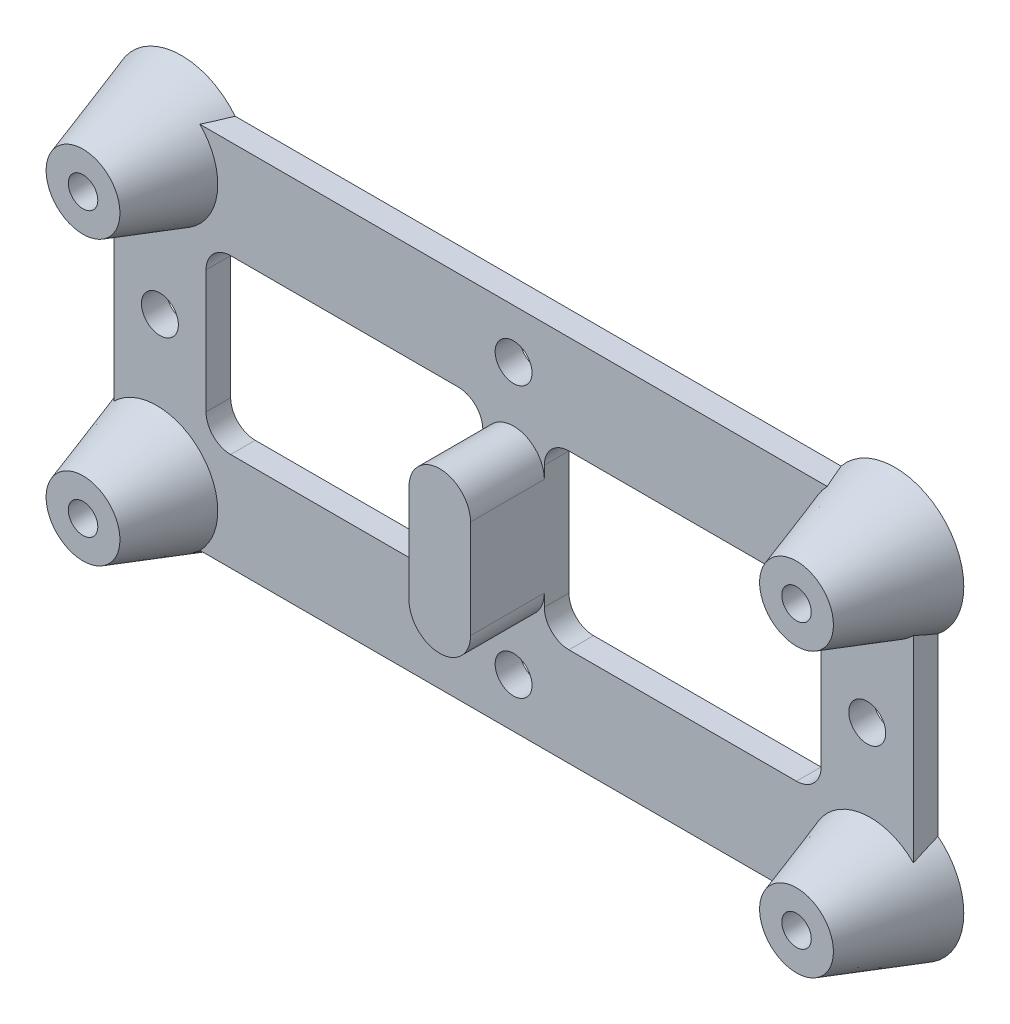
from build123d import *

# Parameters (mm, degrees)
ESQUISSE1_W                  = 65
ESQUISSE1_H                  = 30
BOSS_EXTRU_1_DEPTH           = 2
ESQUISSE2_R                  = 3
BOSS_EXTRU_2_DEPTH           = 8
BOSS_EXTRU_2_DRAFT           = 18
BOSS_EXTRU_2_PROFILE_2_DEPTH = 8
BOSS_EXTRU_2_PROFILE_2_DRAFT = 18
BOSS_EXTRU_2_PROFILE_3_DEPTH = 8
BOSS_EXTRU_2_PROFILE_3_DRAFT = 18
BOSS_EXTRU_2_PROFILE_4_DEPTH = 8
BOSS_EXTRU_2_PROFILE_4_DRAFT = 18
ENL_V_MAT_EXTRU_2_REACH      = 41.058
ESQUISSE4_W                  = 22.5
ESQUISSE4_H                  = 14
ENL_V_MAT_EXTRU_3_REACH      = 41.058
ESQUISSE5_R                  = 1.5
CONG_1_R                     = 2
BOSS_EXTRU_3_REACH           = 41.415
ENL_V_MAT_EXTRU_4_REACH      = 41.415
ESQUISSE7_R                  = 1.2


with BuildPart() as part:
    # Esquisse1 → Boss.-Extru.1 (new body)
    with BuildSketch(Plane.XY):
        Rectangle(ESQUISSE1_W, ESQUISSE1_H)
    extrude(amount=BOSS_EXTRU_1_DEPTH)


with BuildPart() as boss_extru_2_tool:
    # Esquisse2 → Boss.-Extru.2 (with draft: the straight prism first)
    with BuildSketch(Plane.XY.offset(8)):
        with Locations((-29, 11.5)):
            Circle(ESQUISSE2_R)
    extrude(amount=-BOSS_EXTRU_2_DEPTH)
    # Boss.-Extru.2: the draft: its side faces are tilted about the plane it starts from
    boss_extru_2_sides = [boss_extru_2_tool.faces().sort_by_distance(p)[0] for p in [
        (-32, 11.5, 4),
    ]]
    draft(boss_extru_2_sides, Plane.XY.offset(8), BOSS_EXTRU_2_DRAFT)


with BuildPart() as part_1:
    add(part.part)

    # Boss.-Extru.2: add boss_extru_2_tool
    add(boss_extru_2_tool.part)


with BuildPart() as boss_extru_2_profile_2_tool:
    # Esquisse2 → Boss.-Extru.2 profile 2 (with draft: the straight prism first)
    with BuildSketch(Plane.XY.offset(8)):
        with Locations((29, 11.5)):
            Circle(ESQUISSE2_R)
    extrude(amount=-BOSS_EXTRU_2_PROFILE_2_DEPTH)
    # Boss.-Extru.2 profile 2: the draft: its side faces are tilted about the plane it starts from
    boss_extru_2_profile_2_sides = [boss_extru_2_profile_2_tool.faces().sort_by_distance(p)[0] for p in [
        (26, 11.5, 4),
    ]]
    draft(boss_extru_2_profile_2_sides, Plane.XY.offset(8), BOSS_EXTRU_2_PROFILE_2_DRAFT)


with BuildPart() as part_2:
    add(part_1.part)

    # Boss.-Extru.2 profile 2: add boss_extru_2_profile_2_tool
    add(boss_extru_2_profile_2_tool.part)


with BuildPart() as boss_extru_2_profile_3_tool:
    # Esquisse2 → Boss.-Extru.2 profile 3 (with draft: the straight prism first)
    with BuildSketch(Plane.XY.offset(8)):
        with Locations((29, -11.5)):
            Circle(ESQUISSE2_R)
    extrude(amount=-BOSS_EXTRU_2_PROFILE_3_DEPTH)
    # Boss.-Extru.2 profile 3: the draft: its side faces are tilted about the plane it starts from
    boss_extru_2_profile_3_sides = [boss_extru_2_profile_3_tool.faces().sort_by_distance(p)[0] for p in [
        (26, -11.5, 4),
    ]]
    draft(boss_extru_2_profile_3_sides, Plane.XY.offset(8), BOSS_EXTRU_2_PROFILE_3_DRAFT)


with BuildPart() as part_3:
    add(part_2.part)

    # Boss.-Extru.2 profile 3: add boss_extru_2_profile_3_tool
    add(boss_extru_2_profile_3_tool.part)


with BuildPart() as boss_extru_2_profile_4_tool:
    # Esquisse2 → Boss.-Extru.2 profile 4 (with draft: the straight prism first)
    with BuildSketch(Plane.XY.offset(8)):
        with Locations((-29, -11.5)):
            Circle(ESQUISSE2_R)
    extrude(amount=-BOSS_EXTRU_2_PROFILE_4_DEPTH)
    # Boss.-Extru.2 profile 4: the draft: its side faces are tilted about the plane it starts from
    boss_extru_2_profile_4_sides = [boss_extru_2_profile_4_tool.faces().sort_by_distance(p)[0] for p in [
        (-32, -11.5, 4),
    ]]
    draft(boss_extru_2_profile_4_sides, Plane.XY.offset(8), BOSS_EXTRU_2_PROFILE_4_DRAFT)


with BuildPart() as part_4:
    add(part_3.part)

    # Boss.-Extru.2 profile 4: add boss_extru_2_profile_4_tool
    add(boss_extru_2_profile_4_tool.part)

    # Esquisse4 → Enlèv. mat.-Extru.2 (cut, up to next)
    with BuildSketch(Plane.XY.offset(2), mode=Mode.PRIVATE) as enl_v_mat_extru_2_sk1:
        with Locations((13.75, 0)):
            Rectangle(ESQUISSE4_W, ESQUISSE4_H)
    enl_v_mat_extru_2_tool1 = extrude(enl_v_mat_extru_2_sk1.sketch, amount=-ENL_V_MAT_EXTRU_2_REACH, mode=Mode.PRIVATE) & part_4.part
    # Esquisse4 → Enlèv. mat.-Extru.2 (cut, up to next)
    with BuildSketch(Plane.XY.offset(2), mode=Mode.PRIVATE) as enl_v_mat_extru_2_sk2:
        with Locations((-13.75, 0)):
            Rectangle(ESQUISSE4_W, ESQUISSE4_H)
    enl_v_mat_extru_2_tool2 = extrude(enl_v_mat_extru_2_sk2.sketch, amount=-ENL_V_MAT_EXTRU_2_REACH, mode=Mode.PRIVATE) & part_4.part
    add(enl_v_mat_extru_2_tool1.solids().sort_by_distance((13.75, 0, 2))[0], mode=Mode.SUBTRACT)
    add(enl_v_mat_extru_2_tool2.solids().sort_by_distance((-13.75, 0, 2))[0], mode=Mode.SUBTRACT)

    # Esquisse5 → Enlèv. mat.-Extru.3 (cut, up to next)
    with BuildSketch(Plane.XY.offset(2), mode=Mode.PRIVATE) as enl_v_mat_extru_3_sk1:
        with Locations((-28.75, 0)):
            Circle(ESQUISSE5_R)
    enl_v_mat_extru_3_tool1 = extrude(enl_v_mat_extru_3_sk1.sketch, amount=-ENL_V_MAT_EXTRU_3_REACH, mode=Mode.PRIVATE) & part_4.part
    # Esquisse5 → Enlèv. mat.-Extru.3 (cut, up to next)
    with BuildSketch(Plane.XY.offset(2), mode=Mode.PRIVATE) as enl_v_mat_extru_3_sk2:
        with Locations((0, 11)):
            Circle(ESQUISSE5_R)
    enl_v_mat_extru_3_tool2 = extrude(enl_v_mat_extru_3_sk2.sketch, amount=-ENL_V_MAT_EXTRU_3_REACH, mode=Mode.PRIVATE) & part_4.part
    # Esquisse5 → Enlèv. mat.-Extru.3 (cut, up to next)
    with BuildSketch(Plane.XY.offset(2), mode=Mode.PRIVATE) as enl_v_mat_extru_3_sk3:
        with Locations((0, -11)):
            Circle(ESQUISSE5_R)
    enl_v_mat_extru_3_tool3 = extrude(enl_v_mat_extru_3_sk3.sketch, amount=-ENL_V_MAT_EXTRU_3_REACH, mode=Mode.PRIVATE) & part_4.part
    # Esquisse5 → Enlèv. mat.-Extru.3 (cut, up to next)
    with BuildSketch(Plane.XY.offset(2), mode=Mode.PRIVATE) as enl_v_mat_extru_3_sk4:
        with Locations((28.75, 0)):
            Circle(ESQUISSE5_R)
    enl_v_mat_extru_3_tool4 = extrude(enl_v_mat_extru_3_sk4.sketch, amount=-ENL_V_MAT_EXTRU_3_REACH, mode=Mode.PRIVATE) & part_4.part
    add(enl_v_mat_extru_3_tool1.solids().sort_by_distance((-28.75, 0, 2))[0], mode=Mode.SUBTRACT)
    add(enl_v_mat_extru_3_tool2.solids().sort_by_distance((0, 11, 2))[0], mode=Mode.SUBTRACT)
    add(enl_v_mat_extru_3_tool3.solids().sort_by_distance((0, -11, 2))[0], mode=Mode.SUBTRACT)
    add(enl_v_mat_extru_3_tool4.solids().sort_by_distance((28.75, 0, 2))[0], mode=Mode.SUBTRACT)

    # Congé1
    cong_1_edges = [part_4.edges().sort_by_distance(p)[0] for p in [
        (-2.5, 7, 1),
        (-2.5, -7, 1),
        (-25, -7, 1),
        (-25, 7, 1),
        (25, 7, 1),
        (25, -7, 1),
        (2.5, -7, 1),
        (2.5, 7, 1),
    ]]
    fillet(cong_1_edges, radius=CONG_1_R)

    # Esquisse6 → Boss.-Extru.3 (add, up to next)
    with BuildSketch(Plane.XY.offset(8), mode=Mode.PRIVATE) as boss_extru_3_sk1:
        with BuildLine():
            Line((-2.5, -4), (-2.5, 4))
            ThreePointArc((-2.5, 4), (0, 6.5), (2.5, 4))
            Line((2.5, 4), (2.5, -4))
            ThreePointArc((2.5, -4), (0, -6.5), (-2.5, -4))
        make_face()
    boss_extru_3_tool1 = extrude(boss_extru_3_sk1.sketch, amount=-BOSS_EXTRU_3_REACH, mode=Mode.PRIVATE) - part_4.part
    add(boss_extru_3_tool1.solids().sort_by_distance((0, 0, 8))[0])

    # Esquisse7 → Enlèv. mat.-Extru.4 (cut, up to next)
    with BuildSketch(Plane.XY.offset(8), mode=Mode.PRIVATE) as enl_v_mat_extru_4_sk1:
        with Locations((-29, 11.5)):
            Circle(ESQUISSE7_R)
    enl_v_mat_extru_4_tool1 = extrude(enl_v_mat_extru_4_sk1.sketch, amount=-ENL_V_MAT_EXTRU_4_REACH, mode=Mode.PRIVATE) & part_4.part
    # Esquisse7 → Enlèv. mat.-Extru.4 (cut, up to next)
    with BuildSketch(Plane.XY.offset(8), mode=Mode.PRIVATE) as enl_v_mat_extru_4_sk2:
        with Locations((29, 11.5)):
            Circle(ESQUISSE7_R)
    enl_v_mat_extru_4_tool2 = extrude(enl_v_mat_extru_4_sk2.sketch, amount=-ENL_V_MAT_EXTRU_4_REACH, mode=Mode.PRIVATE) & part_4.part
    # Esquisse7 → Enlèv. mat.-Extru.4 (cut, up to next)
    with BuildSketch(Plane.XY.offset(8), mode=Mode.PRIVATE) as enl_v_mat_extru_4_sk3:
        with Locations((29, -11.5)):
            Circle(ESQUISSE7_R)
    enl_v_mat_extru_4_tool3 = extrude(enl_v_mat_extru_4_sk3.sketch, amount=-ENL_V_MAT_EXTRU_4_REACH, mode=Mode.PRIVATE) & part_4.part
    # Esquisse7 → Enlèv. mat.-Extru.4 (cut, up to next)
    with BuildSketch(Plane.XY.offset(8), mode=Mode.PRIVATE) as enl_v_mat_extru_4_sk4:
        with Locations((-29, -11.5)):
            Circle(ESQUISSE7_R)
    enl_v_mat_extru_4_tool4 = extrude(enl_v_mat_extru_4_sk4.sketch, amount=-ENL_V_MAT_EXTRU_4_REACH, mode=Mode.PRIVATE) & part_4.part
    add(enl_v_mat_extru_4_tool1.solids().sort_by_distance((-29, 11.5, 8))[0], mode=Mode.SUBTRACT)
    add(enl_v_mat_extru_4_tool2.solids().sort_by_distance((29, 11.5, 8))[0], mode=Mode.SUBTRACT)
    add(enl_v_mat_extru_4_tool3.solids().sort_by_distance((29, -11.5, 8))[0], mode=Mode.SUBTRACT)
    add(enl_v_mat_extru_4_tool4.solids().sort_by_distance((-29, -11.5, 8))[0], mode=Mode.SUBTRACT)


solid = part_4.part
